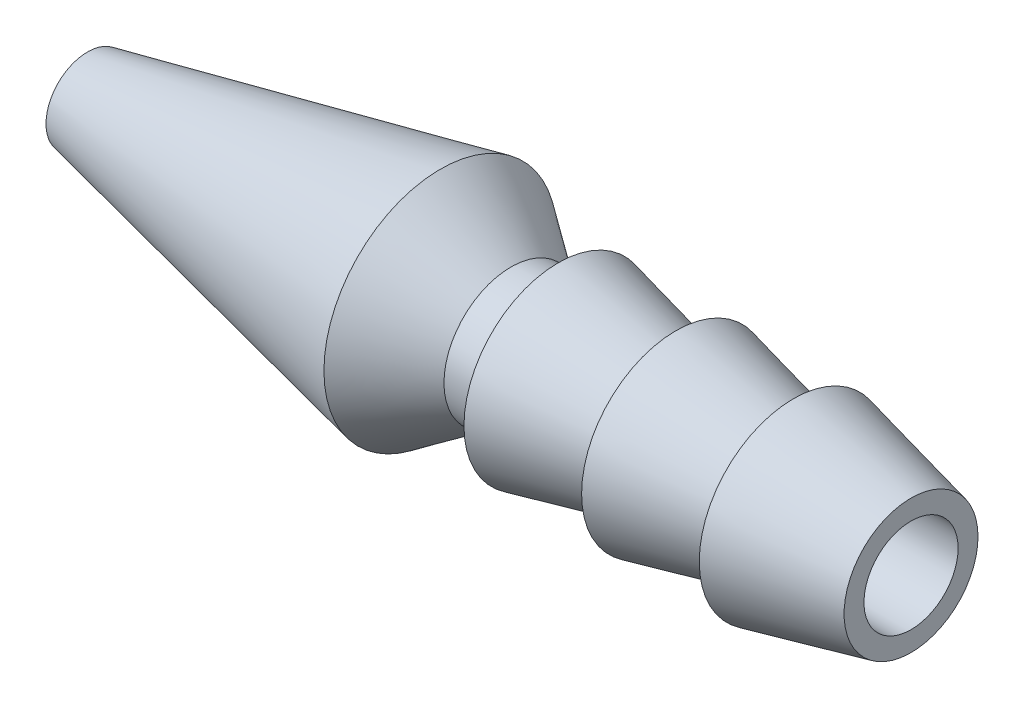
from build123d import *

# Parameters (mm, degrees)
SKETCH1_R           = 4
BOSS_EXTRUDE1_DEPTH = 5
BOSS_EXTRUDE1_TAPER = 13
SKETCH2_R           = 4
BOSS_EXTRUDE2_DEPTH = 5
BOSS_EXTRUDE2_TAPER = 13
SKETCH3_R           = 4
BOSS_EXTRUDE3_DEPTH = 5
BOSS_EXTRUDE3_TAPER = 13
SKETCH4_R           = 2.85
BOSS_EXTRUDE4_DEPTH = 2
SKETCH5_R           = 2.85
BOSS_EXTRUDE5_DEPTH = 3
BOSS_EXTRUDE5_DRAFT = -35
SKETCH6_R           = 4.950622615
BOSS_EXTRUDE6_DEPTH = 15
BOSS_EXTRUDE6_TAPER = 12
SKETCH9_R           = 2
CUT_EXTRUDE1_DEPTH  = 20
SKETCH12_W          = 2.5
SKETCH12_H          = 0.8
CUT_EXTRUDE6_DEPTH  = 10
CUT_EXTRUDE6_TAPER  = -2.8
SKETCH13_R          = 2
CUT_EXTRUDE9_DEPTH  = 15
CUT_EXTRUDE9_DRAFT  = -6.2


with BuildPart() as part:
    # Sketch1 → Boss-Extrude1 (new body)
    with BuildSketch(Plane(origin=(0, 0, 0), x_dir=(0, 0, -1), z_dir=(1, 0, 0))):
        Circle(SKETCH1_R)
    extrude(amount=BOSS_EXTRUDE1_DEPTH, taper=BOSS_EXTRUDE1_TAPER)

    # Sketch2 → Boss-Extrude2 (add)
    with BuildSketch(Plane(origin=(5, 0, 0), x_dir=(0, 0, -1), z_dir=(1, 0, 0))):
        Circle(SKETCH2_R)
    extrude(amount=BOSS_EXTRUDE2_DEPTH, taper=BOSS_EXTRUDE2_TAPER)

    # Sketch3 → Boss-Extrude3 (add)
    with BuildSketch(Plane(origin=(10, 0, 0), x_dir=(0, 0, -1), z_dir=(1, 0, 0))):
        Circle(SKETCH3_R)
    extrude(amount=BOSS_EXTRUDE3_DEPTH, taper=BOSS_EXTRUDE3_TAPER)

    # Sketch4 → Boss-Extrude4 (add)
    with BuildSketch(Plane.ZY):
        Circle(SKETCH4_R)
    extrude(amount=BOSS_EXTRUDE4_DEPTH)


with BuildPart() as boss_extrude5_tool:
    # Sketch5 → Boss-Extrude5 (with draft: the straight prism first)
    with BuildSketch(Plane.ZY.offset(2)):
        Circle(SKETCH5_R)
    extrude(amount=BOSS_EXTRUDE5_DEPTH)
    # Boss-Extrude5: the draft: its side faces are tilted about the plane it starts from
    boss_extrude5_sides = [boss_extrude5_tool.faces().sort_by_distance(p)[0] for p in [
        (-3.5, 0, -2.85),
    ]]
    draft(boss_extrude5_sides, Plane.ZY.offset(2), BOSS_EXTRUDE5_DRAFT)


with BuildPart() as part_1:
    add(part.part)

    # Boss-Extrude5: add boss_extrude5_tool
    add(boss_extrude5_tool.part)

    # Sketch6 → Boss-Extrude6 (add)
    with BuildSketch(Plane.ZY.offset(5)):
        Circle(SKETCH6_R)
    extrude(amount=BOSS_EXTRUDE6_DEPTH, taper=BOSS_EXTRUDE6_TAPER)

    # Sketch9 → Cut-Extrude1 (cut)
    with BuildSketch(Plane(origin=(15, 0, 0), x_dir=(0, 0, -1), z_dir=(1, 0, 0))):
        Circle(SKETCH9_R)
    extrude(amount=-CUT_EXTRUDE1_DEPTH, mode=Mode.SUBTRACT)

    # Sketch12 → Cut-Extrude6 (cut)
    with BuildSketch(Plane.ZY.offset(20)):
        Rectangle(SKETCH12_W, SKETCH12_H)
    extrude(amount=-CUT_EXTRUDE6_DEPTH, taper=CUT_EXTRUDE6_TAPER, mode=Mode.SUBTRACT)


with BuildPart() as cut_extrude9_tool:
    # Sketch13 → Cut-Extrude9 (with draft: the straight prism first)
    with BuildSketch(Plane(origin=(-5, 0, 0), x_dir=(0, 0, -1), z_dir=(1, 0, 0))):
        Circle(SKETCH13_R)
    extrude(amount=-CUT_EXTRUDE9_DEPTH)
    # Cut-Extrude9: the draft: its side faces are tilted about the plane it starts from
    cut_extrude9_sides = [cut_extrude9_tool.faces().sort_by_distance(p)[0] for p in [
        (-12.5, 0, 2),
    ]]
    draft(cut_extrude9_sides, Plane(origin=(-5, 0, 0), x_dir=(0, 0, -1), z_dir=(1, 0, 0)), CUT_EXTRUDE9_DRAFT)


with BuildPart() as part_2:
    add(part_1.part)

    # Cut-Extrude9: cut by cut_extrude9_tool
    add(cut_extrude9_tool.part, mode=Mode.SUBTRACT)


solid = part_2.part
